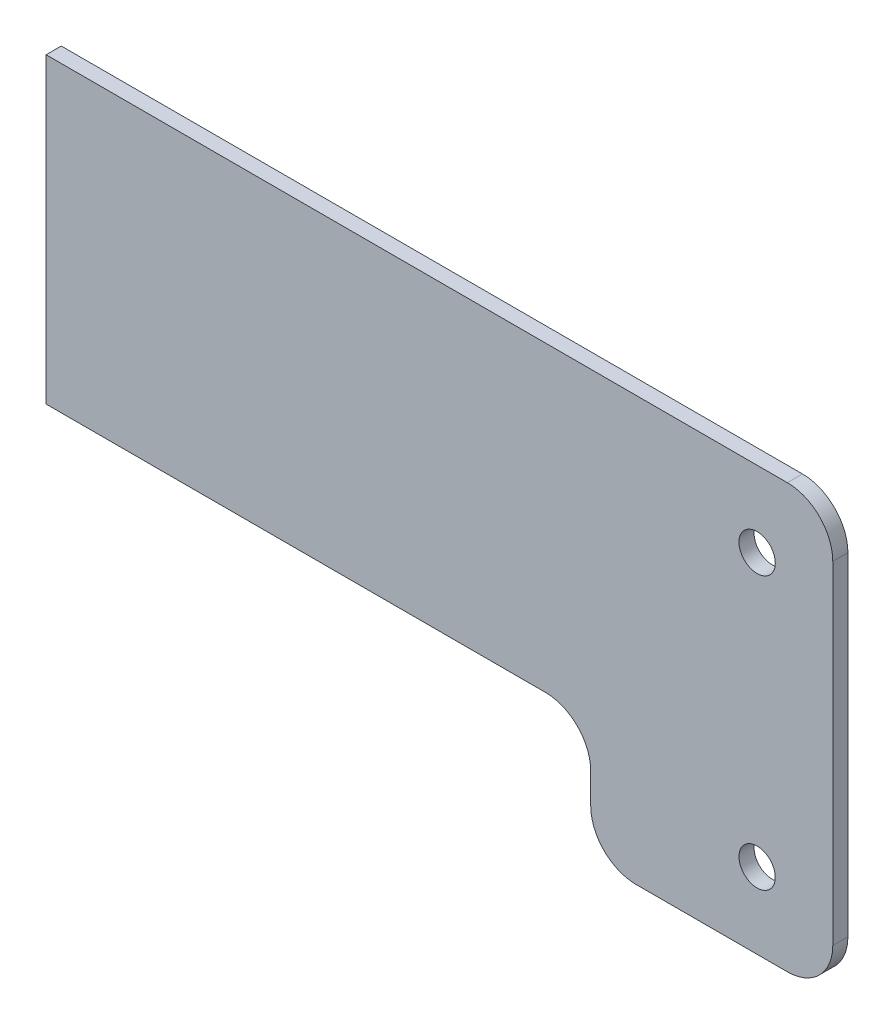
from build123d import *

# Parameters (mm, degrees)
SKETCH1_R           = 6
BOSS_EXTRUDE1_DEPTH = 2.5


with BuildPart() as part:
    # Sketch1 → Boss-Extrude1 (new, symmetric)
    with BuildSketch(Plane.XY):
        with BuildLine():
            Line((-122.5, 70), (122.5, 70))
            ThreePointArc((122.5, 70), (133.106601718, 65.606601718), (137.5, 55))
            Line((137.5, 55), (137.5, -55))
            ThreePointArc((137.5, -55), (133.106601718, -65.606601718), (122.5, -70))
            Line((122.5, -70), (72.5, -70))
            ThreePointArc((72.5, -70), (61.893398282, -65.606601718), (57.5, -55))
            Line((57.5, -55), (57.5, -45))
            ThreePointArc((57.5, -45), (53.106601718, -34.393398282), (42.5, -30))
            Line((42.5, -30), (-122.5, -30))
            Line((-122.5, -30), (-122.5, 70))
        make_face()
        with Locations((112.5, 45)):
            Circle(SKETCH1_R, mode=Mode.SUBTRACT)
        with Locations(Location((112.5, -45, 0), (0, 0, 180))):
            Circle(SKETCH1_R, mode=Mode.SUBTRACT)
    extrude(amount=BOSS_EXTRUDE1_DEPTH, both=True)


solid = part.part
